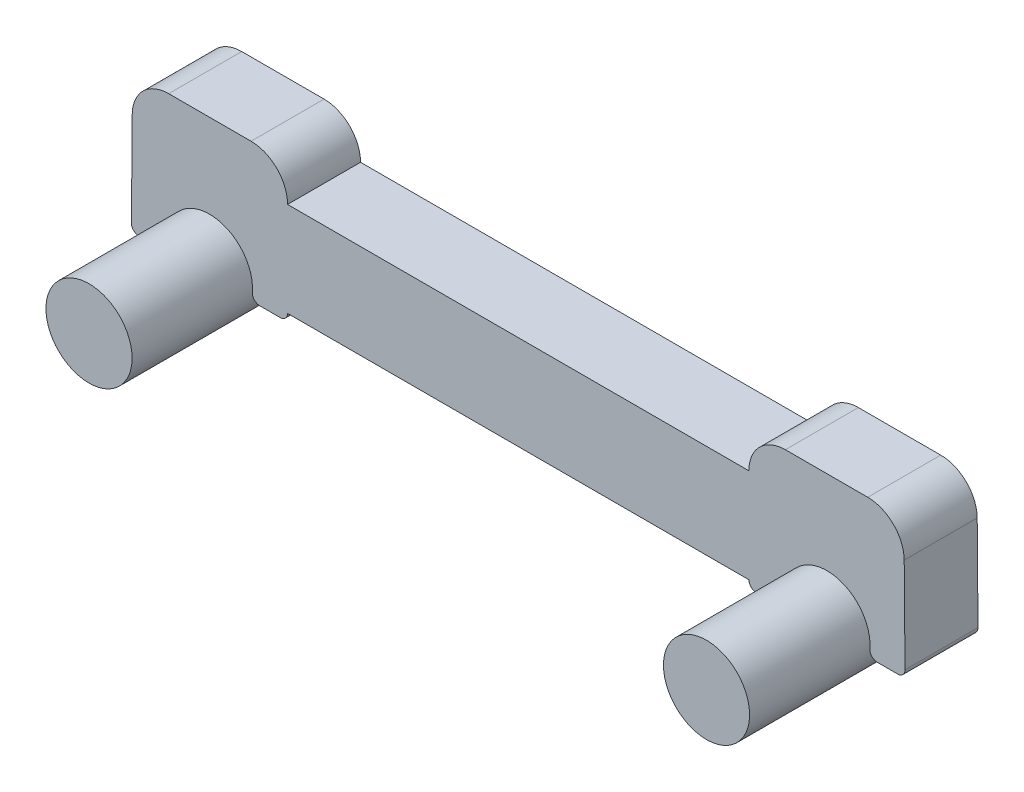
from build123d import *

# Parameters (mm, degrees)
SKETCH1_R           = 1.4986
BOSS_EXTRUDE1_DEPTH = 6.731
BOSS_EXTRUDE2_DEPTH = 2.54
SKETCH3_W           = 2.54
SKETCH3_H           = 3.283466221
BOSS_EXTRUDE3_DEPTH = 8.0264


with BuildPart() as part:
    # Sketch1 → Boss-Extrude1 (new body)
    with BuildSketch(Plane.XY):
        Circle(SKETCH1_R)
    extrude(amount=BOSS_EXTRUDE1_DEPTH)

    # Sketch2 → Boss-Extrude2 (add)
    with BuildSketch(Plane(origin=(0, 0, 0), x_dir=(-1, 0, 0), z_dir=(0, 0, -1))):
        with BuildLine():
            Line((-1.74748007, -0.387866221), (-2.463536443, -0.387866221))
            ThreePointArc((-2.463536443, -0.387866221), (-2.643141566, -0.313471343), (-2.717536443, -0.133866221))
            Line((-2.717536443, -0.133866221), (-2.717536443, 3.1496))
            ThreePointArc((-2.717536443, 3.1496), (-2.345562055, 4.047625612), (-1.447536443, 4.4196))
            Line((-1.447536443, 4.4196), (1.417916008, 4.4196))
            ThreePointArc((1.417916008, 4.4196), (2.312179766, 4.051371774), (2.687871622, 3.160217845))
            Line((2.687871622, 3.160217845), (2.715395045, -0.131742652))
            ThreePointArc((2.715395045, -0.131742652), (2.641758277, -0.312718973), (2.461403923, -0.387866221))
            Line((2.461403923, -0.387866221), (1.74748007, -0.387866221))
            ThreePointArc((1.74748007, -0.387866221), (1.561141898, -0.306475854), (1.494222089, -0.114465319))
            ThreePointArc((1.494222089, -0.114465319), (0, 1.4986), (-1.494222089, -0.114465319))
            ThreePointArc((-1.494222089, -0.114465319), (-1.561141898, -0.306475854), (-1.74748007, -0.387866221))
        make_face()
    extrude(amount=-BOSS_EXTRUDE2_DEPTH)

    # Sketch3 → Boss-Extrude3 (add)
    with BuildSketch(Plane(origin=(2.717536443, 0, 0), x_dir=(0, 0, -1), z_dir=(1, 0, 0))):
        with Locations((-1.27, 1.50786689)):
            Rectangle(SKETCH3_W, SKETCH3_H)
    extrude(amount=BOSS_EXTRUDE3_DEPTH)

    # Mirror4: part across plane


with BuildPart() as part_1:
    add(part.part)
    add(part.part.mirror(Plane(origin=(10.743936443, 0, 0), x_dir=(0, 0, 1), z_dir=(1, 0, 0))))


solid = part_1.part
